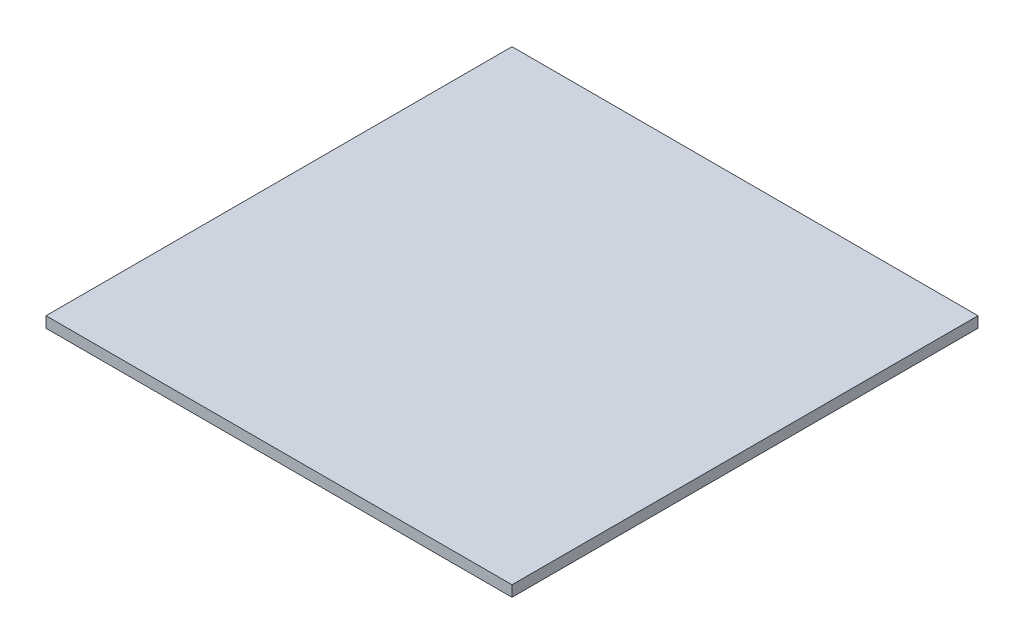
from build123d import *

# Parameters (mm, degrees)
BOSS_EXTRUDE1_DEPTH = 5


with BuildPart() as part:
    # Sketch1 → Boss-Extrude1 (new body)
    with BuildSketch(Plane(origin=(0, 0, 0), x_dir=(1, 0, 0), z_dir=(0, 1, 0))):
        Polygon((-107, 0), (-107, 107), (107, 107), (107, -107), (-107, -107), align=None)
    extrude(amount=BOSS_EXTRUDE1_DEPTH)


solid = part.part
